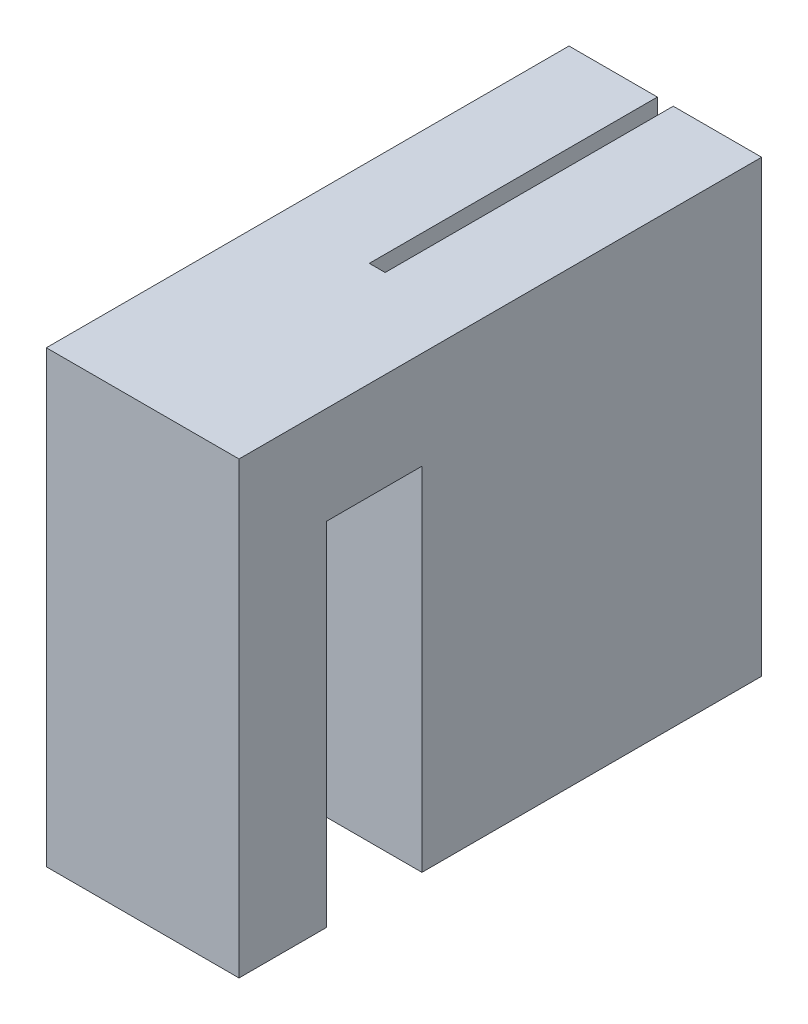
from build123d import *

# Parameters (mm, degrees)
BOSS_EXTRUDE1_DEPTH = 0.912
BOSS_EXTRUDE2_DEPTH = 5.08
BOSS_EXTRUDE3_DEPTH = 5.08


with BuildPart() as part:
    # Sketch1 → Boss-Extrude1 (new body)
    with BuildSketch(Plane(origin=(0, 0, 0), x_dir=(0, 0, -1), z_dir=(1, 0, 0))):
        Polygon((0, 0), (5.014983062, 0), (5.014983062, 20.218431916), (10.514983062, 20.218431916), (10.514983062, 0), (30.0377124, 0), (30.0377124, 9.933664863), (13.47996686, 9.933664863), (13.47996686, 25.83493591), (0, 25.83493591), align=None)
    extrude(amount=-BOSS_EXTRUDE1_DEPTH)

    # Sketch1<3> → Boss-Extrude2 (add)
    with BuildSketch(Plane(origin=(0, 0, 0), x_dir=(0, 0, -1), z_dir=(1, 0, 0))):
        Polygon((0, 0), (5.014983062, 0), (5.014983062, 20.218431916), (10.514983062, 20.218431916), (10.514983062, 0), (30.0377124, 0), (30.0377124, 25.83493591), (0, 25.83493591), align=None)
    extrude(amount=BOSS_EXTRUDE2_DEPTH)

    # Sketch2 → Boss-Extrude3 (add)
    with BuildSketch(Plane.ZY.offset(0.912)):
        Polygon((-30.0377124, 25.83493591), (0, 25.83493591), (0, 0), (-5.014983062, 0), (-5.014983062, 20.218431916), (-10.514983062, 20.218431916), (-10.514983062, 0), (-30.0377124, 0), align=None)
    extrude(amount=BOSS_EXTRUDE3_DEPTH)


solid = part.part
